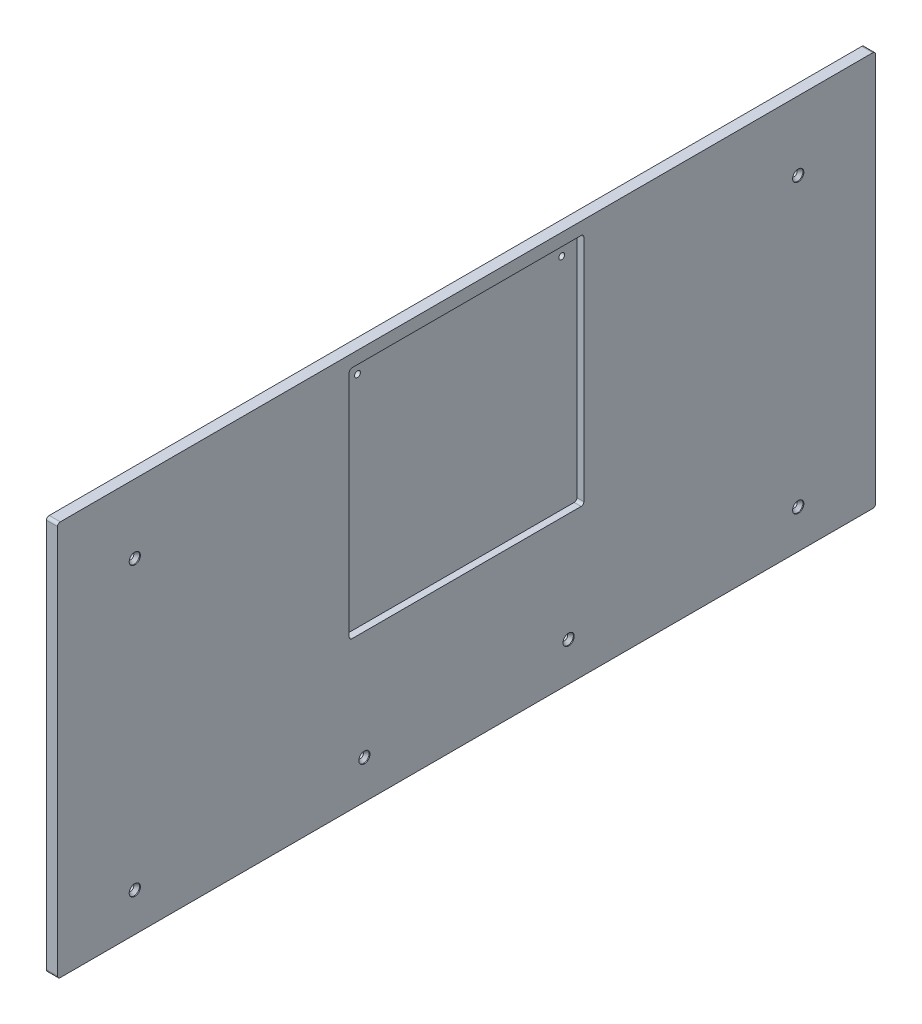
from build123d import *

# Parameters (mm, degrees)
SKETCH1_W                                     = 940.88204
SKETCH1_H                                     = 454.025
SKETCH1_R                                     = 3.3734375
BOSS_EXTRUDE1_DEPTH                           = 12.7
FILLET1_R                                     = 3.175
SKETCH2_W                                     = 269.875
SKETCH2_H                                     = 269.875
CUT_EXTRUDE1_DEPTH                            = 7.9375
FILLET2_R                                     = 3.175
CSK_FOR_1_4_FLAT_HEAD_MACHINE_SCREW1_AT_COUNT = 2
CSK_FOR_1_4_FLAT_HEAD_MACHINE_SCREW1_AT_PITCH = 763.08204
CSK_FOR_1_4_FLAT_HEAD_MACHINE_SCREW1_2_COUNT  = 2
CSK_FOR_1_4_FLAT_HEAD_MACHINE_SCREW1_2_PITCH  = 330.2
CSK_FOR_1_4_FLAT_HEAD_MACHINE_SCREW1_3_COUNT  = 2
CSK_FOR_1_4_FLAT_HEAD_MACHINE_SCREW1_3_PITCH  = 422.803622168
CSK_FOR_1_4_FLAT_HEAD_MACHINE_SCREW1_4_COUNT  = 2
CSK_FOR_1_4_FLAT_HEAD_MACHINE_SCREW1_4_PITCH  = 598.371981477
CSK_FOR_1_4_FLAT_HEAD_MACHINE_SCREW1_5_COUNT  = 2
CSK_FOR_1_4_FLAT_HEAD_MACHINE_SCREW1_5_PITCH  = 831.460305589


with BuildPart() as part:
    # Sketch1 → Boss-Extrude1 (new body)
    with BuildSketch(Plane(origin=(0, 0, 0), x_dir=(0, 0, -1), z_dir=(1, 0, 0))):
        with Locations((470.44102, 227.0125)):
            Rectangle(SKETCH1_W, SKETCH1_H)
        with Locations((352.96602, 422.275)):
            Circle(SKETCH1_R, mode=Mode.SUBTRACT)
        with Locations((587.91602, 422.275)):
            Circle(SKETCH1_R, mode=Mode.SUBTRACT)
    extrude(amount=BOSS_EXTRUDE1_DEPTH)

    # Fillet1
    fillet1_edges = [part.edges().sort_by_distance(p)[0] for p in [
        (6.35, 454.025, 0),
        (6.35, 454.025, -940.88204),
        (6.35, 0, -940.88204),
        (6.35, 0, 0),
    ]]
    fillet(fillet1_edges, radius=FILLET1_R)

    # Sketch2 → Cut-Extrude1 (cut)
    with BuildSketch(Plane(origin=(12.7, 0, 0), x_dir=(0, 0, -1), z_dir=(1, 0, 0))):
        with Locations((470.44102, 304.8)):
            Rectangle(SKETCH2_W, SKETCH2_H)
    extrude(amount=-CUT_EXTRUDE1_DEPTH, mode=Mode.SUBTRACT)

    # Fillet2
    fillet2_edges = [part.edges().sort_by_distance(p)[0] for p in [
        (8.73125, 169.8625, -335.50352),
        (8.73125, 439.7375, -335.50352),
        (8.73125, 439.7375, -605.37852),
        (8.73125, 169.8625, -605.37852),
    ]]
    fillet(fillet2_edges, radius=FILLET2_R)

    # Sketch5 → CSK for 1/4 Flat Head Machine Screw1 (revolve, cut)
    with BuildSketch(Plane(origin=(12.7, 374.65, -88.9), x_dir=(0, 0, -1), z_dir=(0, 1, 0))):
        Polygon((0, 0), (0, 12.7), (3.3782, 12.7), (3.3782, 4.536932584), (6.4389, 1.016), (6.4389, 0), align=None)
    csk_for_1_4_flat_head_machine_screw1 = revolve(axis=Axis((19.05, 374.65, -88.9), (-1, 0, 0)), mode=Mode.SUBTRACT)

    # CSK for 1/4 Flat Head Machine Screw1 at: CSK for 1/4 Flat Head Machine Screw1 ×2
    with Locations(*[(0, 0, -i * CSK_FOR_1_4_FLAT_HEAD_MACHINE_SCREW1_AT_PITCH) for i in range(1, CSK_FOR_1_4_FLAT_HEAD_MACHINE_SCREW1_AT_COUNT)]):
        add(csk_for_1_4_flat_head_machine_screw1, mode=Mode.SUBTRACT)

    # CSK for 1_4 Flat Head Machine Screw1 2: CSK for 1/4 Flat Head Machine Screw1 ×2
    with Locations(*[(0, -i * CSK_FOR_1_4_FLAT_HEAD_MACHINE_SCREW1_2_PITCH, 0) for i in range(1, CSK_FOR_1_4_FLAT_HEAD_MACHINE_SCREW1_2_COUNT)]):
        add(csk_for_1_4_flat_head_machine_screw1, mode=Mode.SUBTRACT)

    # CSK for 1_4 Flat Head Machine Screw1 3: CSK for 1/4 Flat Head Machine Screw1 ×2
    with Locations(*[Vector(0, -0.7809772260384187, -0.6245595026971703) * (i * CSK_FOR_1_4_FLAT_HEAD_MACHINE_SCREW1_3_PITCH) for i in range(1, CSK_FOR_1_4_FLAT_HEAD_MACHINE_SCREW1_3_COUNT)]):
        add(csk_for_1_4_flat_head_machine_screw1, mode=Mode.SUBTRACT)

    # CSK for 1_4 Flat Head Machine Screw1 4: CSK for 1/4 Flat Head Machine Screw1 ×2
    with Locations(*[Vector(0, -0.5518306508686767, -0.833956193550868) * (i * CSK_FOR_1_4_FLAT_HEAD_MACHINE_SCREW1_4_PITCH) for i in range(1, CSK_FOR_1_4_FLAT_HEAD_MACHINE_SCREW1_4_COUNT)]):
        add(csk_for_1_4_flat_head_machine_screw1, mode=Mode.SUBTRACT)

    # CSK for 1_4 Flat Head Machine Screw1 5: CSK for 1/4 Flat Head Machine Screw1 ×2
    with Locations(*[Vector(0, -0.39713260847250104, -0.9177612387150741) * (i * CSK_FOR_1_4_FLAT_HEAD_MACHINE_SCREW1_5_PITCH) for i in range(1, CSK_FOR_1_4_FLAT_HEAD_MACHINE_SCREW1_5_COUNT)]):
        add(csk_for_1_4_flat_head_machine_screw1, mode=Mode.SUBTRACT)


solid = part.part
